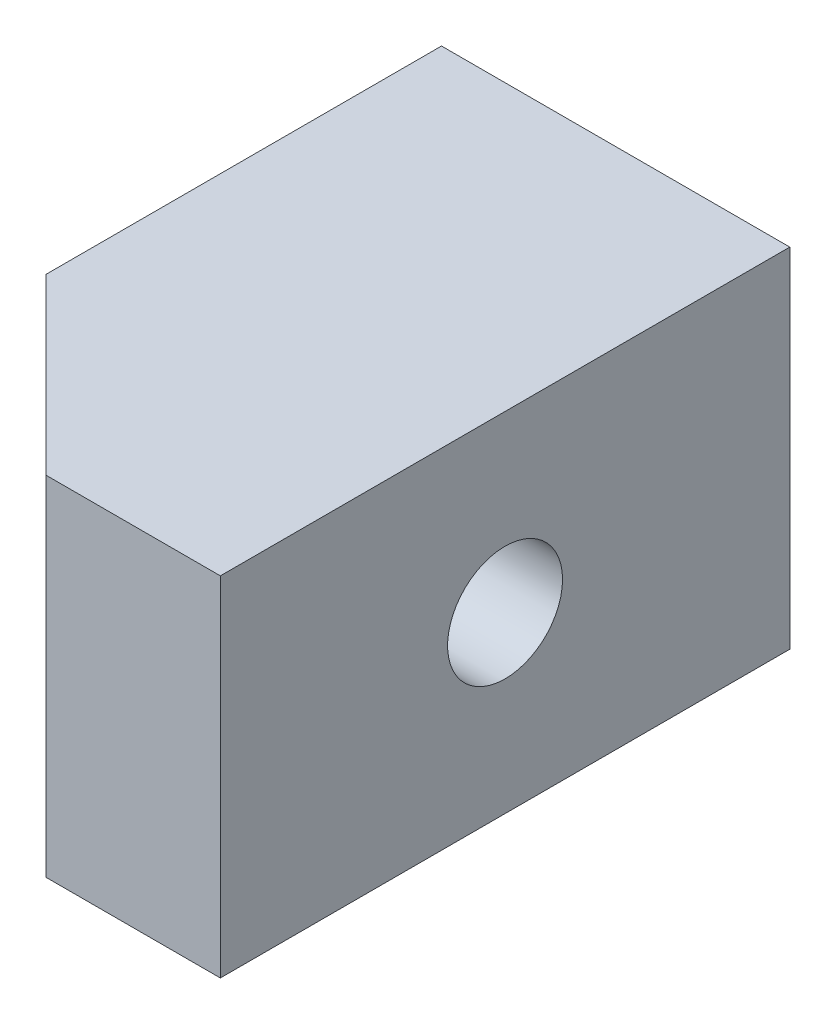
from build123d import *

# Parameters (mm, degrees)
SKETCH1_W                 = 10
SKETCH1_H                 = 16.35
BOSS_EXTRUDE1_DEPTH       = 10
CHAMFER1_SIZE             = 5
M4X0_7_TAPPED_HOLE1_D     = 3.3
M4X0_7_TAPPED_HOLE1_DEPTH = 4.825
M4X0_7_TAPPED_HOLE1_TIP   = 0.991420021
M4X0_7_TAPPED_HOLE2_D     = 3.3
M4X0_7_TAPPED_HOLE2_DEPTH = 4.825
M4X0_7_TAPPED_HOLE2_TIP   = 0.991420021


with BuildPart() as part:
    # Sketch1 → Boss-Extrude1 (new body)
    with BuildSketch(Plane(origin=(0, 0, 0), x_dir=(1, 0, 0), z_dir=(0, 1, 0))):
        Rectangle(SKETCH1_W, SKETCH1_H)
    extrude(amount=BOSS_EXTRUDE1_DEPTH)

    # Chamfer1
    chamfer1_edges = [part.edges().sort_by_distance(p)[0] for p in [
        (-5, 5, 8.175),
    ]]
    chamfer(chamfer1_edges, length=CHAMFER1_SIZE)

    # M4x0.7 Tapped Hole1
    with Locations(Plane(origin=(5, 0, 0), x_dir=(0, 0, -1), z_dir=(1, 0, 0))):
        with Locations((0, 5)):
            Hole(M4X0_7_TAPPED_HOLE1_D / 2, depth=M4X0_7_TAPPED_HOLE1_DEPTH)
            with Locations((0, 0, -(M4X0_7_TAPPED_HOLE1_DEPTH + M4X0_7_TAPPED_HOLE1_TIP / 2))):  # 118° drill point
                Cone(0, M4X0_7_TAPPED_HOLE1_D / 2, M4X0_7_TAPPED_HOLE1_TIP, mode=Mode.SUBTRACT)

    # M4x0.7 Tapped Hole2
    with Locations(Plane(origin=(0, 0, -8.175), x_dir=(-1, 0, 0), z_dir=(0, 0, -1))):
        with Locations((0, 5)):
            Hole(M4X0_7_TAPPED_HOLE2_D / 2, depth=M4X0_7_TAPPED_HOLE2_DEPTH)
            with Locations((0, 0, -(M4X0_7_TAPPED_HOLE2_DEPTH + M4X0_7_TAPPED_HOLE2_TIP / 2))):  # 118° drill point
                Cone(0, M4X0_7_TAPPED_HOLE2_D / 2, M4X0_7_TAPPED_HOLE2_TIP, mode=Mode.SUBTRACT)


solid = part.part
